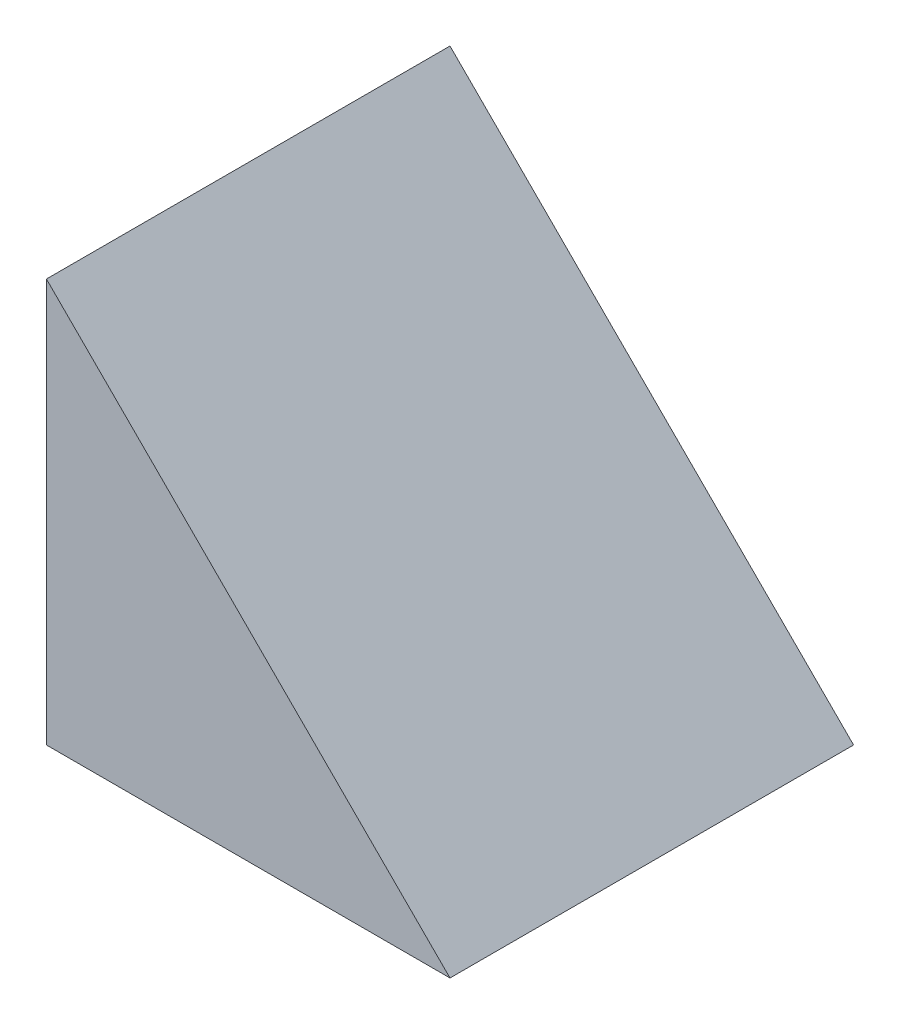
from build123d import *

# Parameters (mm, degrees)
BOSS_EXTRUDE1_DEPTH = 114.3


with BuildPart() as part:
    # Sketch1 → Boss-Extrude1 (new body)
    with BuildSketch(Plane.XY):
        Polygon((0, 0), (114.3, 0), (0, 114.3), align=None)
    extrude(amount=BOSS_EXTRUDE1_DEPTH)


solid = part.part
